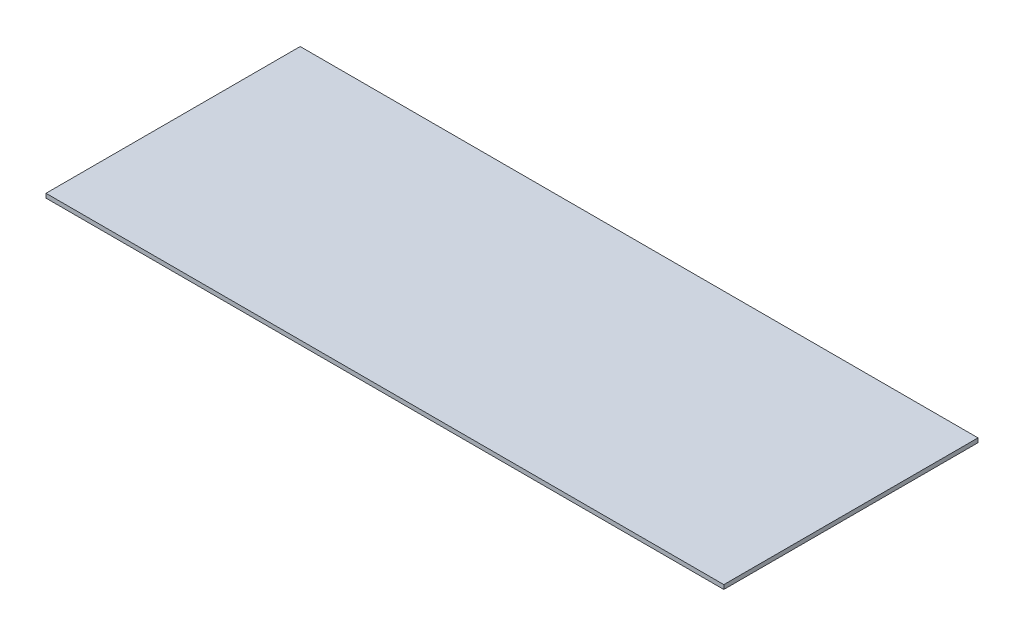
from build123d import *

# Parameters (mm, degrees)
SKETCH_1_W      = 406.4
SKETCH_1_H      = 152.4
EXTRUDE_1_DEPTH = 2.54


with BuildPart() as part:
    # 草图1 → 凸台-拉伸1 (new body)
    with BuildSketch(Plane(origin=(0, 0, 0), x_dir=(1, 0, 0), z_dir=(0, 1, 0))):
        with Locations((203.2, -76.2)):
            Rectangle(SKETCH_1_W, SKETCH_1_H)
    extrude(amount=EXTRUDE_1_DEPTH)


solid = part.part
